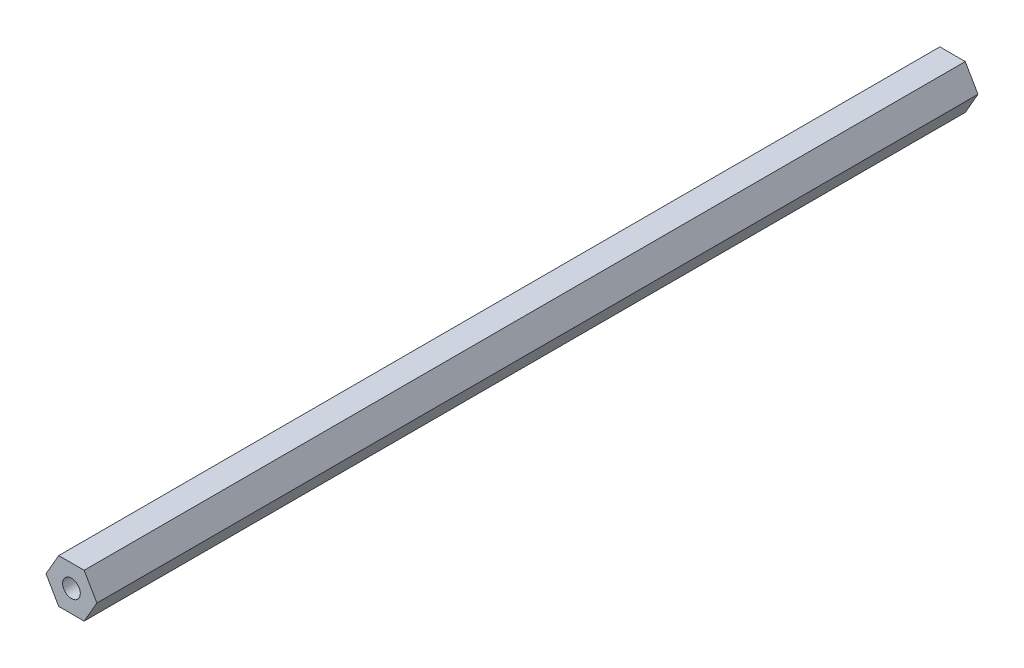
from build123d import *

# Parameters (mm, degrees)
SKETCH1_R           = 2.5527
BOSS_EXTRUDE1_DEPTH = 254


with BuildPart() as part:
    # Sketch1 → Boss-Extrude1 (new body)
    with BuildSketch(Plane.XY):
        Polygon((7.332348419, 0), (3.666174209, 6.35), (-3.666174209, 6.35), (-7.332348419, 0), (-3.666174209, -6.35), (3.666174209, -6.35), align=None)
        Circle(SKETCH1_R, mode=Mode.SUBTRACT)
    extrude(amount=BOSS_EXTRUDE1_DEPTH)


solid = part.part
